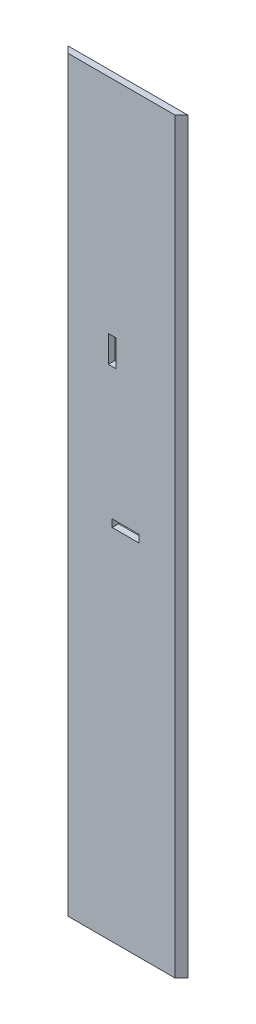
from build123d import *

# Parameters (mm, degrees)
SKETCH1_W           = 350
SKETCH1_H           = 50
BOSS_EXTRUDE1_DEPTH = 3
BOSS_EXTRUDE2_DEPTH = 350
SKETCH3_OUTSIDE_W   = 128.892
SKETCH3_OUTSIDE_H   = 422.892
SKETCH3_OUTSIDE_W_2 = 56
SKETCH3_OUTSIDE_H_2 = 350
SKETCH3_OUTSIDE_W_3 = 12.5
SKETCH3_OUTSIDE_H_3 = 3.5
SKETCH3_OUTSIDE_W_4 = 3.5
SKETCH3_OUTSIDE_H_4 = 12.5
CUT_EXTRUDE2_DEPTH  = 178.251234128


with BuildPart() as part:
    # Sketch1 → Boss-Extrude1 (new body)
    with BuildSketch(Plane(origin=(0, 0, 0), x_dir=(0, 1, 0), z_dir=(0, 0, 1))):
        Rectangle(SKETCH1_W, SKETCH1_H)
    extrude(amount=BOSS_EXTRUDE1_DEPTH)

    # Sketch2 → Boss-Extrude2 (add, through all)
    with BuildSketch(Plane.XZ.offset(175)):
        Polygon((-25, 3), (-25, 0), (-28, 0), align=None)
        Polygon((25, 3), (28, 0), (25, 0), align=None)
    extrude(amount=-BOSS_EXTRUDE2_DEPTH)

    # Sketch3 outside → Cut-Extrude2 (cut, through all)
    # profile 1 of 3: a face of its own
    with BuildSketch(Plane(origin=(0, 0, 0), x_dir=(1, 0, 0), z_dir=(0, 0, -1))):
        Rectangle(SKETCH3_OUTSIDE_W, SKETCH3_OUTSIDE_H)
        Rectangle(SKETCH3_OUTSIDE_W_2, SKETCH3_OUTSIDE_H_2, mode=Mode.SUBTRACT)
    # profile 2 of 3: a face of its own
    with BuildSketch(Plane(origin=(0, 0, 0), x_dir=(1, 0, 0), z_dir=(0, 0, -1))):
        with Locations((1.788055669, 5.25)):
            Rectangle(SKETCH3_OUTSIDE_W_3, SKETCH3_OUTSIDE_H_3)
    # profile 3 of 3: a face of its own
    with BuildSketch(Plane(origin=(0, 0, 0), x_dir=(1, 0, 0), z_dir=(0, 0, -1))):
        with Locations((-4.440759591, -64.557376571)):
            Rectangle(SKETCH3_OUTSIDE_W_4, SKETCH3_OUTSIDE_H_4)
    extrude(amount=-CUT_EXTRUDE2_DEPTH, mode=Mode.SUBTRACT)


solid = part.part
